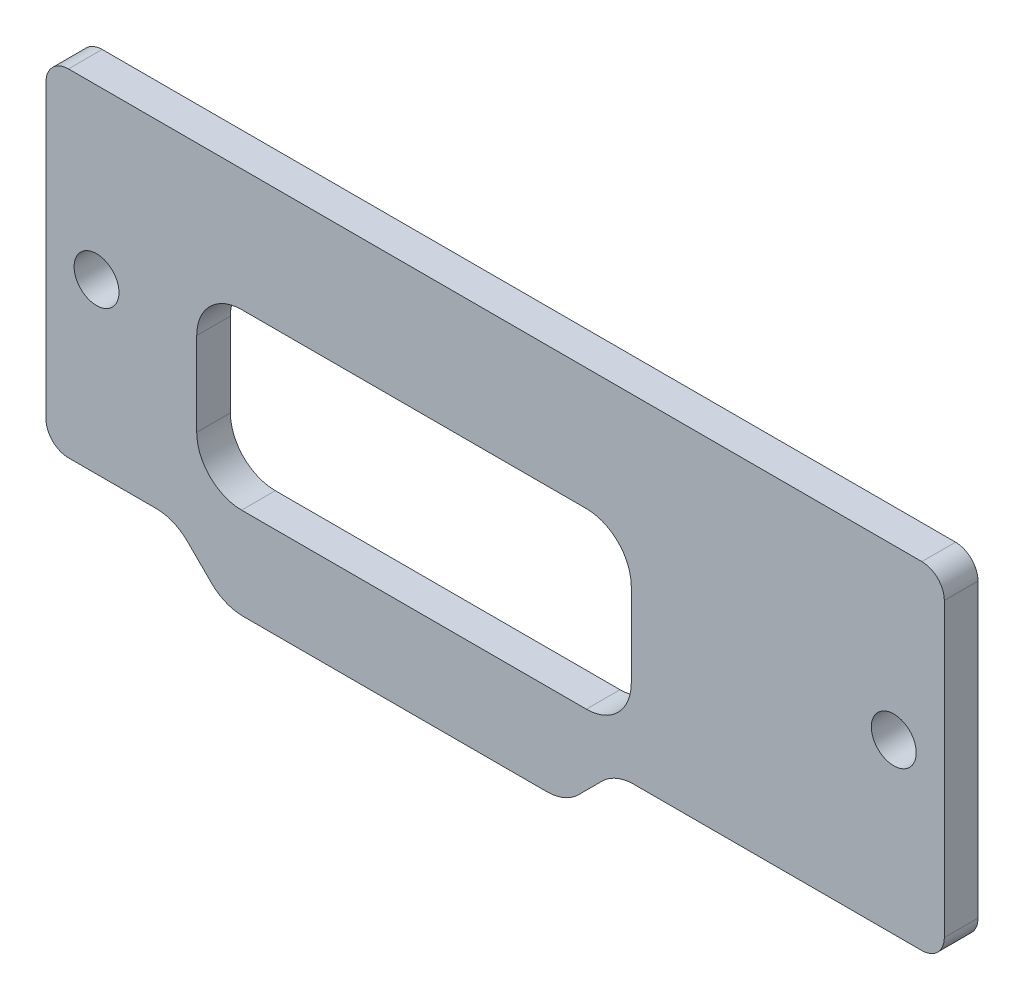
from build123d import *

# Parameters (mm, degrees)
SKETCH_1_W          = 40
SKETCH_1_H          = 15
SKETCH_1_R          = 1
EXTRUDE_1_DEPTH     = 1.5
SKETCH_2_W          = 19.349402369
SKETCH_2_H          = 7.733193781
CUT_EXTRUDE_1_DEPTH = 1.5
FILLET_2_R          = 1
FILLET_3_R          = 2
EXTRUDE_2_DEPTH     = 1.5
FILLET_4_R          = 2


with BuildPart() as part:
    # 草图1 → 凸台-拉伸1 (new body)
    with BuildSketch(Plane.XY):
        with Locations((-3.988440653, 4.336799691)):
            Rectangle(SKETCH_1_W, SKETCH_1_H)
        with Locations((-21.738440653, 4.336799691)):
            Circle(SKETCH_1_R, mode=Mode.SUBTRACT)
        with Locations((13.761559347, 4.336799691)):
            Circle(SKETCH_1_R, mode=Mode.SUBTRACT)
    extrude(amount=EXTRUDE_1_DEPTH)

    # 草图2 → 切除-拉伸1 (cut)
    with BuildSketch(Plane.XY.offset(1.5)):
        with Locations((-7.602725981, 2.54307272)):
            Rectangle(SKETCH_2_W, SKETCH_2_H)
    extrude(amount=-CUT_EXTRUDE_1_DEPTH, mode=Mode.SUBTRACT)

    # 圆角2
    fillet_2_edges = [part.edges().sort_by_distance(p)[0] for p in [
        (16.011559347, -3.163200309, 0.75),
        (-23.988440653, -3.163200309, 0.75),
        (-23.988440653, 11.836799691, 0.75),
        (16.011559347, 11.836799691, 0.75),
    ]]
    fillet(fillet_2_edges, radius=FILLET_2_R)

    # 圆角3
    fillet_3_edges = [part.edges().sort_by_distance(p)[0] for p in [
        (2.071975204, 6.40966961, 0.75),
        (2.071975204, -1.323524171, 0.75),
        (-17.277427165, -1.323524171, 0.75),
        (-17.277427165, 6.40966961, 0.75),
    ]]
    fillet(fillet_3_edges, radius=FILLET_3_R)

    # 草图3 → 凸台-拉伸2 (add)
    with BuildSketch(Plane.XY.offset(1.5)):
        Polygon((-18.839640509, -2.587666371), (-16.040814973, -5.386491907), (-0.864084954, -5.386491907), (2.88813454, -1.634272413), align=None)
    extrude(amount=-EXTRUDE_2_DEPTH)

    # 圆角4
    fillet_4_edges = [part.edges().sort_by_distance(p)[0] for p in [
        (-18.26410657, -3.163200309, 0.75),
        (1.359206644, -3.163200309, 0.75),
        (-16.040814973, -5.386491907, 0.75),
        (-0.864084954, -5.386491907, 0.75),
    ]]
    fillet(fillet_4_edges, radius=FILLET_4_R)


solid = part.part
